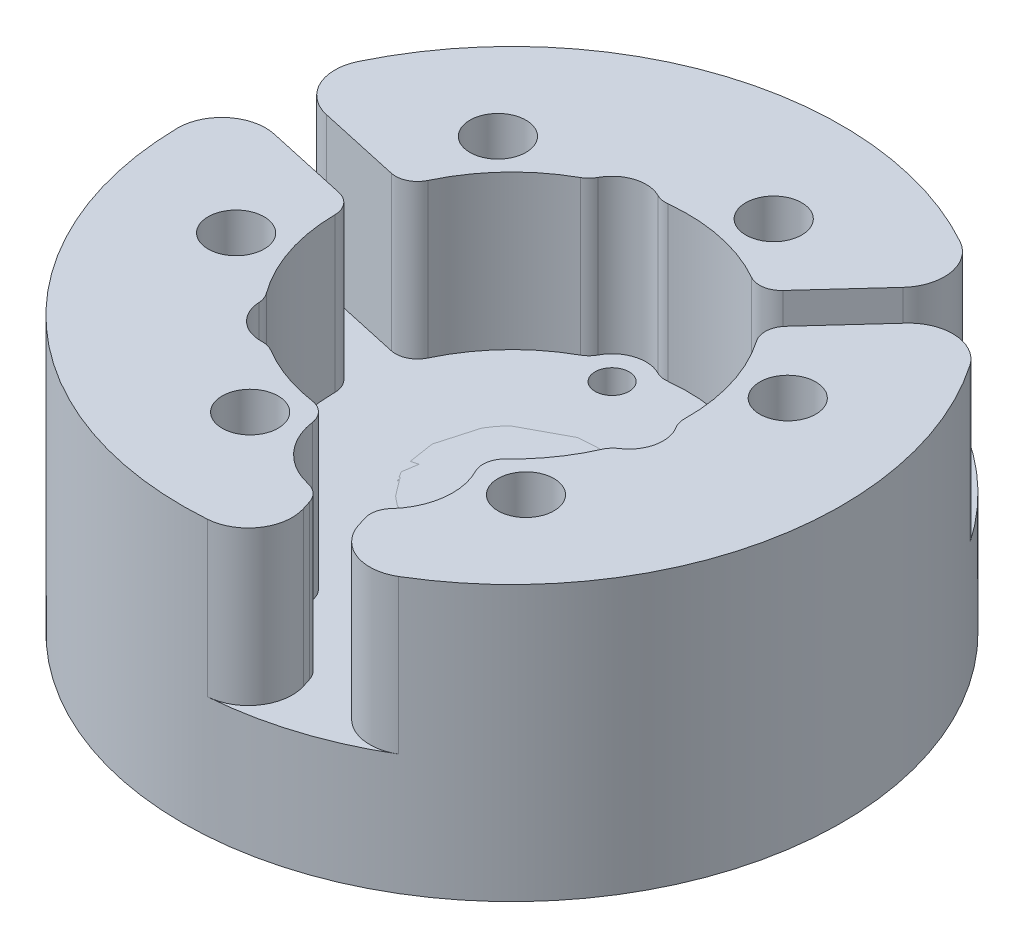
from build123d import *

# Parameters (mm, degrees)
SKETCH_1_R          = 30
EXTRUDE_1_DEPTH     = 25
SKETCH_3_R          = 2.55
CUT_EXTRUDE_2_DEPTH = 50.244289009
SKETCH_2_R          = 1.55
CUT_EXTRUDE_1_DEPTH = 50.244289009
SKETCH_6_R          = 16
SKETCH_6_R_2        = 6
CUT_EXTRUDE_4_DEPTH = 14
CUT_EXTRUDE_5_DEPTH = 14
SKETCH_9_R          = 5.05
CUT_EXTRUDE_6_DEPTH = 6
SKETCH_11_R         = 3.1
CUT_EXTRUDE_7_DEPTH = 14
FILLET_1_R          = 4
FILLET_2_R          = 1
FILLET_3_R          = 2
SKETCH_12_R         = 7.5
EXTRUDE_2_DEPTH     = 2


with BuildPart() as part:
    # 草图1 → 凸台-拉伸1 (new body)
    with BuildSketch(Plane(origin=(0, 0, 0), x_dir=(1, 0, 0), z_dir=(0, 1, 0))):
        with Locations(Location((0, 0, 0), (0, 0, 270))):
            Circle(SKETCH_1_R)
    extrude(amount=EXTRUDE_1_DEPTH)

    # 草图3 → 切除-拉伸2 (cut, through all)
    with BuildSketch(Plane(origin=(0, 25, 0), x_dir=(1, 0, 0), z_dir=(0, 1, 0))):
        with Locations(Location((-14.765844318, 13.489619771, 0), (0, 0, 270))):
            Circle(SKETCH_3_R)
        with Locations(Location((4.299431251, 19.532406173, 0), (0, 0, 270))):
            Circle(SKETCH_3_R)
        with Locations(Location((19.065275568, 6.042786402, 0), (0, 0, 270))):
            Circle(SKETCH_3_R)
        with Locations(Location((14.765844318, -13.489619771, 0), (0, 0, 270))):
            Circle(SKETCH_3_R)
        with Locations(Location((-4.299431251, -19.532406173, 0), (0, 0, 270))):
            Circle(SKETCH_3_R)
        with Locations(Location((-19.065275568, -6.042786402, 0), (0, 0, 270))):
            Circle(SKETCH_3_R)
    extrude(amount=-CUT_EXTRUDE_2_DEPTH, mode=Mode.SUBTRACT)

    # 草图2 → 切除-拉伸1 (cut, through all)
    with BuildSketch(Plane(origin=(0, 25, 0), x_dir=(1, 0, 0), z_dir=(0, 1, 0))):
        with Locations(Location((-4.229950481, 13.345692898, 0), (0, 0, 270))):
            Circle(SKETCH_2_R)
        with Locations(Location((13.672684321, -3.009601875, 0), (0, 0, 270))):
            Circle(SKETCH_2_R)
        with Locations(Location((-9.44273384, -10.336091023, 0), (0, 0, 270))):
            Circle(SKETCH_2_R)
        Polygon((-1.289829375, -5.859721852), (4.429753295, -4.046885931), (5.719582671, 1.812835921), (1.289829375, 5.859721852), (-4.429753295, 4.046885931), (-5.719582671, -1.812835921), align=None)
    extrude(amount=-CUT_EXTRUDE_1_DEPTH, mode=Mode.SUBTRACT)

    # 草图6 → 切除-拉伸4 (cut)
    with BuildSketch(Plane(origin=(0, 25, 0), x_dir=(1, 0, 0), z_dir=(0, 1, 0))):
        Circle(SKETCH_6_R)
        with Locations((5.287438102, -16.682116122)):
            Circle(SKETCH_6_R_2)
    extrude(amount=-CUT_EXTRUDE_4_DEPTH, mode=Mode.SUBTRACT)

    # 草图8 → 切除-拉伸5 (cut)
    with BuildSketch(Plane(origin=(0, 11, 0), x_dir=(1, 0, 0), z_dir=(0, 1, 0))):
        with BuildLine():
            Line((-15.073423647, 5.365808378), (-34.919954427, 9.734384061))
            ThreePointArc((-34.919954427, 9.734384061), (-37.303138169, 8.211086569), (-35.779840677, 5.827902826))
            Line((-35.779840677, 5.827902826), (-15.933309897, 1.459327143))
            ThreePointArc((-15.933309897, 1.459327143), (-15.625924939, 3.439545), (-15.073423647, 5.365808378))
        make_face()
        with BuildLine():
            ThreePointArc((8.903123755, -21.470311738), (7.100274022, -22.401698793), (5.090068642, -22.678869018))
            Line((5.090068642, -22.678869018), (9.029753326, -35.108759663))
            ThreePointArc((9.029753326, -35.108759663), (11.540559523, -36.41100858), (12.84280844, -33.900202383))
            Line((12.84280844, -33.900202383), (8.903123755, -21.470311738))
        make_face()
        with BuildLine():
            Line((22.937032237, 28.072299556), (9.230469327, 13.068987566))
            ThreePointArc((9.230469327, 13.068987566), (10.791695817, 11.812675454), (12.183638191, 10.371063612))
            Line((12.183638191, 10.371063612), (25.8902011, 25.374375602))
            ThreePointArc((25.8902011, 25.374375602), (25.762578646, 28.199922011), (22.937032237, 28.072299556))
        make_face()
    extrude(amount=CUT_EXTRUDE_5_DEPTH, mode=Mode.SUBTRACT)

    # 草图9 → 切除-拉伸6 (cut)
    with BuildSketch(Plane.XZ):
        with Locations(Location((-4.299431251, 19.532406173, 0), (0, 0, 270))):
            Circle(SKETCH_9_R)
        with Locations(Location((14.765844318, 13.489619771, 0), (0, 0, 270))):
            Circle(SKETCH_9_R)
        with Locations(Location((19.065275568, -6.042786402, 0), (0, 0, 270))):
            Circle(SKETCH_9_R)
        with Locations(Location((4.299431251, -19.532406173, 0), (0, 0, 270))):
            Circle(SKETCH_9_R)
        with Locations(Location((-14.765844318, -13.489619771, 0), (0, 0, 270))):
            Circle(SKETCH_9_R)
        with Locations(Location((-19.065275568, 6.042786402, 0), (0, 0, 270))):
            Circle(SKETCH_9_R)
    extrude(amount=-CUT_EXTRUDE_6_DEPTH, mode=Mode.SUBTRACT)

    # 草图11 → 切除-拉伸7 (cut)
    with BuildSketch(Plane(origin=(0, 25, 0), x_dir=(1, 0, 0), z_dir=(0, 1, 0))):
        with Locations((-9.44273384, -10.336091023)):
            Circle(SKETCH_11_R)
        with Locations((13.672684321, -3.009601875)):
            Circle(SKETCH_11_R)
        with Locations((-4.229950481, 13.345692898)):
            Circle(SKETCH_11_R)
    extrude(amount=-CUT_EXTRUDE_7_DEPTH, mode=Mode.SUBTRACT)

    # 圆角1
    fillet_1_edges = [part.edges().sort_by_distance(p)[0] for p in [
        (-28.803485611, 18, -8.388040096),
        (-29.663371861, 18, -4.481558862),
        (7.137486994, 18, 29.138570305),
        (10.950542108, 18, 27.930013024),
        (21.665998617, 18, -20.750530209),
        (18.712829753, 18, -23.448454163),
    ]]
    fillet(fillet_1_edges, radius=FILLET_1_R)

    # 圆角2
    fillet_2_edges = [part.edges().sort_by_distance(p)[0] for p in [
        (-1.289829375, 5.5, 5.859721852),
        (-5.719582671, 5.5, 1.812835921),
        (-4.429753295, 5.5, -4.046885931),
        (1.289829375, 5.5, -5.859721852),
        (5.719582671, 5.5, -1.812835921),
        (4.429753295, 5.5, 4.046885931),
    ]]
    fillet(fillet_2_edges, radius=FILLET_2_R)

    # 圆角3
    fillet_3_edges = [part.edges().sort_by_distance(p)[0] for p in [
        (-15.073423647, 18, -5.365808378),
        (-15.933309897, 18, -1.459327143),
        (5.090068642, 18, 22.678869018),
        (8.903123755, 18, 21.470311738),
        (12.183638191, 18, -10.371063612),
        (9.230469327, 18, -13.068987566),
        (-8.793005403, 18, 13.367238158),
        (-12.520112064, 18, 9.962268513),
        (15.972870525, 18, 0.931346976),
        (14.887633643, 18, 5.861600849),
        (-7.179865122, 18, -14.298585134),
        (-2.367521579, 18, -15.823869362),
        (-0.672029659, 18, 15.985880524),
        (9.757790642, 18, 12.680123098),
    ]]
    fillet(fillet_3_edges, radius=FILLET_3_R)


with BuildPart() as body_2:
    # 草图12 → 凸台-拉伸2 (new body)
    with BuildSketch(Plane(origin=(0, 11, 0), x_dir=(1, 0, 0), z_dir=(0, 1, 0))):
        with Locations(Location((0, 0, 0), (0, 0, 270))):
            Circle(SKETCH_12_R)
    extrude(amount=-EXTRUDE_2_DEPTH)


solid = Compound([part.part, body_2.part])
